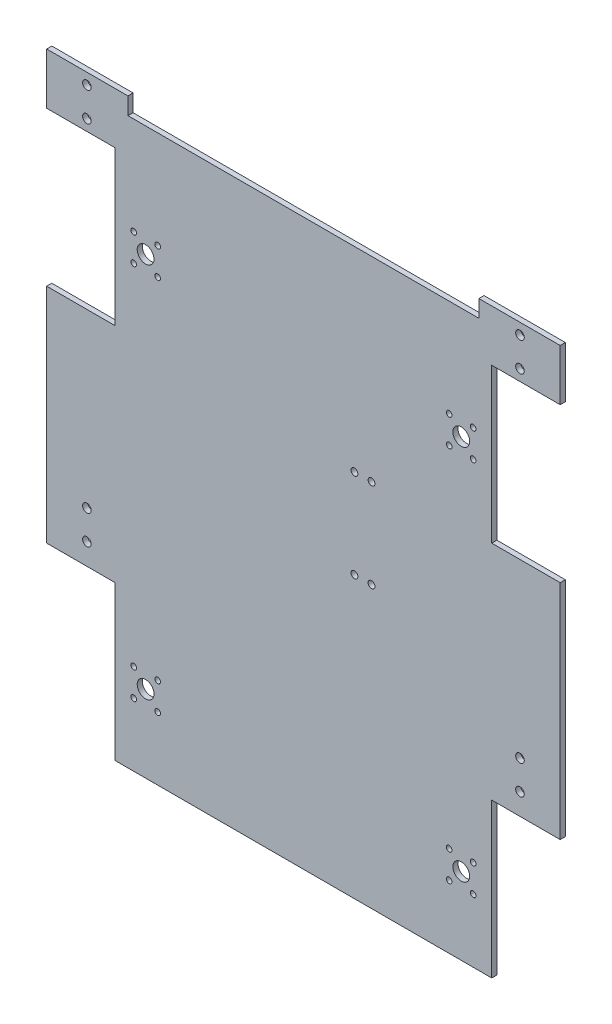
from build123d import *

# Parameters (mm, degrees)
SKETCH_2_R      = 1.65
SKETCH_2_R_2    = 4.9
SKETCH_2_R_3    = 2.5
SKETCH_2_R_4    = 2
EXTRUDE_1_DEPTH = 3


with BuildPart() as part:
    # 草图2 → 凸台-拉伸1 (new body)
    with BuildSketch(Plane.XY):
        Polygon((40, 0), (260, 0), (260, 90), (300, 90), (300, 220), (260, 220), (260, 310), (300, 310), (300, 340), (252.5, 340), (252.5, 330), (47.5, 330), (47.5, 340), (0, 340), (0, 310), (40, 310), (40, 220), (0, 220), (0, 90), (40, 90), align=None)
        with Locations((50.85, 273)):
            Circle(SKETCH_2_R, mode=Mode.SUBTRACT)
        with Locations((64.85, 273)):
            Circle(SKETCH_2_R, mode=Mode.SUBTRACT)
        with Locations((64.85, 257)):
            Circle(SKETCH_2_R, mode=Mode.SUBTRACT)
        with Locations((50.85, 257)):
            Circle(SKETCH_2_R, mode=Mode.SUBTRACT)
        with Locations((57.8, 265)):
            Circle(SKETCH_2_R_2, mode=Mode.SUBTRACT)
        with Locations((235.15, 257)):
            Circle(SKETCH_2_R, mode=Mode.SUBTRACT)
        with Locations((249.15, 257)):
            Circle(SKETCH_2_R, mode=Mode.SUBTRACT)
        with Locations((242.2, 265)):
            Circle(SKETCH_2_R_2, mode=Mode.SUBTRACT)
        with Locations((235.15, 273)):
            Circle(SKETCH_2_R, mode=Mode.SUBTRACT)
        with Locations((249.15, 273)):
            Circle(SKETCH_2_R, mode=Mode.SUBTRACT)
        with Locations((249.15, 53)):
            Circle(SKETCH_2_R, mode=Mode.SUBTRACT)
        with Locations((235.15, 53)):
            Circle(SKETCH_2_R, mode=Mode.SUBTRACT)
        with Locations((249.15, 37)):
            Circle(SKETCH_2_R, mode=Mode.SUBTRACT)
        with Locations((242.2, 45)):
            Circle(SKETCH_2_R_2, mode=Mode.SUBTRACT)
        with Locations((235.15, 37)):
            Circle(SKETCH_2_R, mode=Mode.SUBTRACT)
        with Locations((50.85, 53)):
            Circle(SKETCH_2_R, mode=Mode.SUBTRACT)
        with Locations((64.85, 53)):
            Circle(SKETCH_2_R, mode=Mode.SUBTRACT)
        with Locations((64.85, 37)):
            Circle(SKETCH_2_R, mode=Mode.SUBTRACT)
        with Locations((57.8, 45)):
            Circle(SKETCH_2_R_2, mode=Mode.SUBTRACT)
        with Locations((50.85, 37)):
            Circle(SKETCH_2_R, mode=Mode.SUBTRACT)
        with Locations((23.5, 333.5)):
            Circle(SKETCH_2_R_3, mode=Mode.SUBTRACT)
        with Locations((23.5, 316.5)):
            Circle(SKETCH_2_R_3, mode=Mode.SUBTRACT)
        with Locations((276.5, 316.5)):
            Circle(SKETCH_2_R_3, mode=Mode.SUBTRACT)
        with Locations((276.5, 333.5)):
            Circle(SKETCH_2_R_3, mode=Mode.SUBTRACT)
        with Locations((23.5, 119.5)):
            Circle(SKETCH_2_R_3, mode=Mode.SUBTRACT)
        with Locations((23.5, 102.5)):
            Circle(SKETCH_2_R_3, mode=Mode.SUBTRACT)
        with Locations((276.5, 102.5)):
            Circle(SKETCH_2_R_3, mode=Mode.SUBTRACT)
        with Locations((276.5, 119.5)):
            Circle(SKETCH_2_R_3, mode=Mode.SUBTRACT)
        with Locations((179.787668085, 215.90015868)):
            Circle(SKETCH_2_R_4, mode=Mode.SUBTRACT)
        with Locations((189.787668085, 215.90015868)):
            Circle(SKETCH_2_R_4, mode=Mode.SUBTRACT)
        with Locations((179.787668085, 163.90015868)):
            Circle(SKETCH_2_R_4, mode=Mode.SUBTRACT)
        with Locations((189.787668085, 163.90015868)):
            Circle(SKETCH_2_R_4, mode=Mode.SUBTRACT)
    extrude(amount=EXTRUDE_1_DEPTH)


solid = part.part
